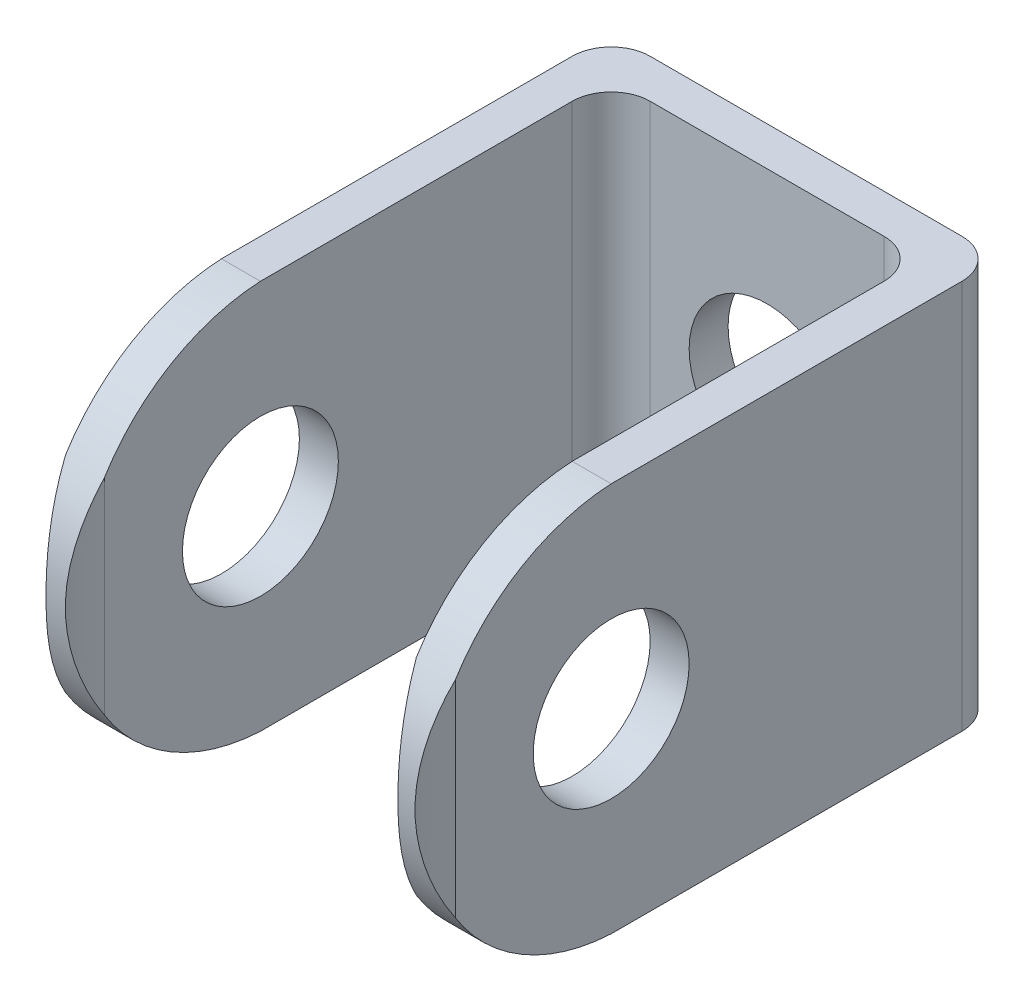
from build123d import *

# Parameters (mm, degrees)
EXTRUDE_1_DEPTH      = 10
SKETCH_3_R           = 2
CUT_EXTRUDE_3_DEPTH  = 10
CUT_EXTRUDE_19_DEPTH = 10
SKETCH_15_R          = 2
CUT_EXTRUDE_20_DEPTH = 10


with BuildPart() as part:
    # Эскиз1 → Бобышка-Вытянуть1 (new body)
    with BuildSketch(Plane(origin=(0, 0, 0), x_dir=(1, 0, 0), z_dir=(0, 1, 0))):
        with BuildLine():
            Line((0, 1), (0, 14))
            ThreePointArc((0, 14), (0.292893219, 14.707106781), (1, 15))
            Line((1, 15), (9, 15))
            ThreePointArc((9, 15), (9.707106781, 14.707106781), (10, 14))
            Line((10, 14), (10, 1))
            add(Edge.make_bspline(
                [(9, 1), (9.166666667, 0.5), (9.5, -0.5), (9.833333333, 0.5), (10, 1)],
                knots=[0, 0, 0, 0, 0.5, 1, 1, 1, 1], degree=3))
            Line((9, 1), (9, 13))
            ThreePointArc((9, 13), (8.707106781, 13.707106781), (8, 14))
            Line((8, 14), (2, 14))
            ThreePointArc((2, 14), (1.292893219, 13.707106781), (1, 13))
            Line((1, 13), (1, 1))
            add(Edge.make_bspline(
                [(0, 1), (0.5, -1), (1, 1)],
                knots=[0, 0, 0, 1, 1, 1], degree=2))
        make_face()
    extrude(amount=EXTRUDE_1_DEPTH)

    # Эскиз3 → Вырез-Вытянуть3 (cut)
    with BuildSketch(Plane(origin=(10, 0, 0), x_dir=(0, 0, -1), z_dir=(1, 0, 0))):
        with Locations((5, 5)):
            Circle(SKETCH_3_R)
    extrude(amount=-CUT_EXTRUDE_3_DEPTH, mode=Mode.SUBTRACT)

    # Эскиз14 → Вырез-Вытянуть19 (cut)
    with BuildSketch(Plane(origin=(0, 0, 0), x_dir=(0, 0, -1), z_dir=(1, 0, 0))):
        with BuildLine():
            Line((5, 10), (0, 10))
            Line((0, 10), (0, 0))
            Line((0, 0), (5, 0))
            ThreePointArc((5, 0), (0.246325104, 5), (5, 10))
        make_face()
    extrude(amount=CUT_EXTRUDE_19_DEPTH, mode=Mode.SUBTRACT)

    # Эскиз15 → Вырез-Вытянуть20 (cut)
    with BuildSketch(Plane(origin=(0, 0, -15), x_dir=(-1, 0, 0), z_dir=(0, 0, -1))):
        with Locations((-5, 5)):
            Circle(SKETCH_15_R)
    extrude(amount=-CUT_EXTRUDE_20_DEPTH, mode=Mode.SUBTRACT)


solid = part.part
